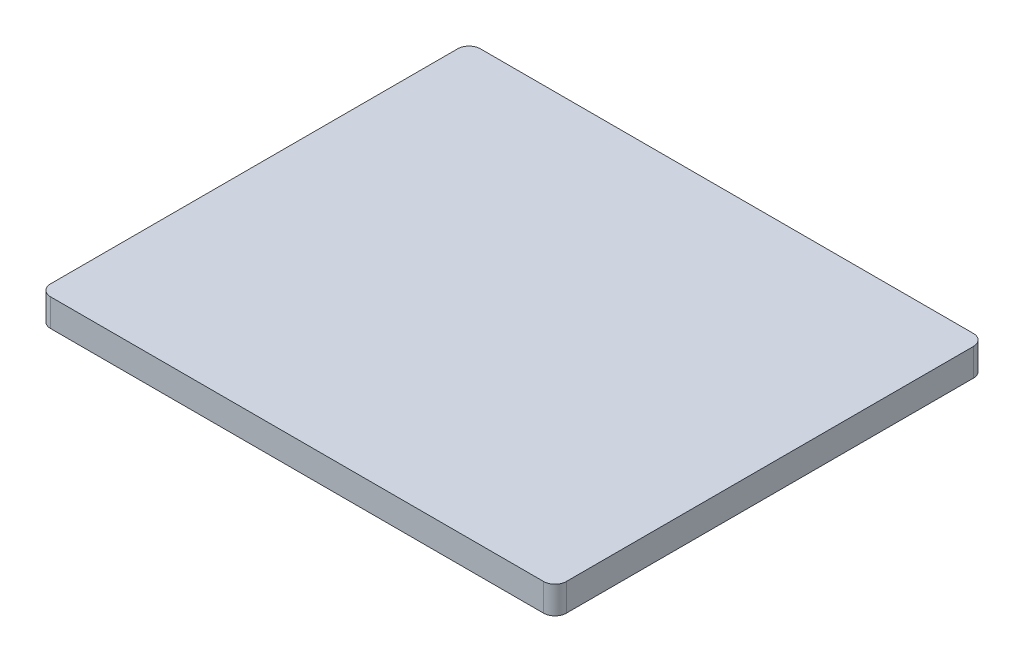
from build123d import *

# Parameters (mm, degrees)
SALIENTE_EXTRUIR1_DEPTH = 16


with BuildPart() as part:
    # Croquis1 → Saliente-Extruir1 (new body)
    with BuildSketch(Plane(origin=(0, 0, 0), x_dir=(1, 0, 0), z_dir=(0, 1, 0))):
        with BuildLine():
            Line((-143.396, 125), (143.396, 125))
            ThreePointArc((143.396, 125), (148.065733183, 123.065733183), (150, 118.396))
            Line((150, 118.396), (150, -118.396))
            ThreePointArc((150, -118.396), (148.065733183, -123.065733183), (143.396, -125))
            Line((143.396, -125), (-143.396, -125))
            ThreePointArc((-143.396, -125), (-148.065733183, -123.065733183), (-150, -118.396))
            Line((-150, -118.396), (-150, 118.396))
            ThreePointArc((-150, 118.396), (-148.065733183, 123.065733183), (-143.396, 125))
        make_face()
    extrude(amount=SALIENTE_EXTRUIR1_DEPTH)


solid = part.part
